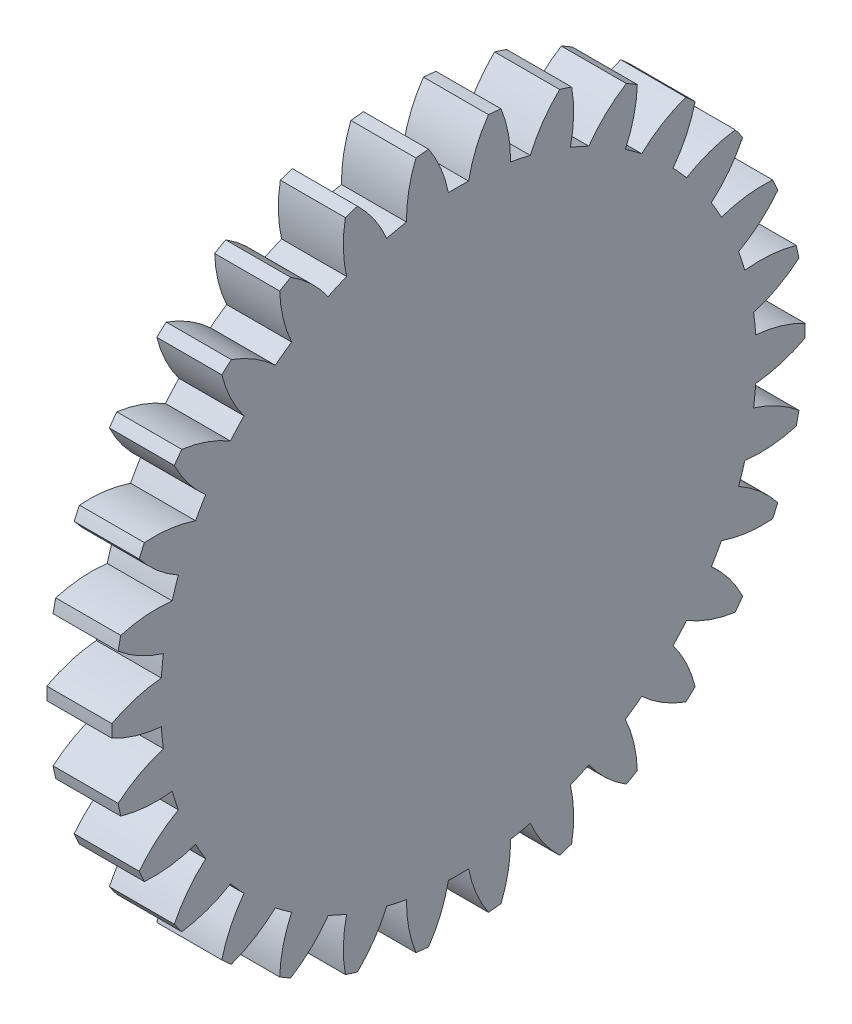
from build123d import *

# Parameters (mm, degrees)
BASPROSKE_W     = 3
BASPROSKE_H     = 16
TOOTHCUT_DEPTH  = 23.825424421
TEETHCUTS_COUNT = 30
TEETHCUTS_ANGLE = 348
BORSKE_R        = 4
BORE_DEPTH      = 50.0000508
EXTRUDE_START   = -3
SKETCH_1_R      = 4
EXTRUDE_1_DEPTH = 3


with BuildPart() as part:
    # BasProSke → Base-Revolve (revolve)
    with BuildSketch(Plane(origin=(0, 0, 0), x_dir=(1, 0, 0), z_dir=(0, 1, 0)), mode=Mode.PRIVATE) as base_revolve_sk:
        with Locations((1.5, 8)):
            Rectangle(BASPROSKE_W, BASPROSKE_H)
    revolve(base_revolve_sk.sketch.rotate(Axis((-10, 0, 0), (1, 0, 0)), 180), axis=Axis((-10, 0, 0), (1, 0, 0)))

    # TooCutSke → ToothCut (cut, through all)
    with BuildSketch(Plane(origin=(0, 0, 0), x_dir=(0, 0, -1), z_dir=(1, 0, 0))):
        with BuildLine():
            ThreePointArc((0.466400716, 13.741086979), (0, 13.749), (-0.466400716, 13.741086979))
            ThreePointArc((-0.466400716, 13.741086979), (-0.819142092, 14.899954875), (-1.3974676, 15.964351834))
            ThreePointArc((-1.3974676, 15.964351834), (0, 16.0254), (1.3974676, 15.964351834))
            ThreePointArc((1.3974676, 15.964351834), (0.819142092, 14.899954875), (0.466400716, 13.741086979))
        make_face()
    toothcut = extrude(amount=TOOTHCUT_DEPTH, mode=Mode.SUBTRACT)

    # TeethCuts: ToothCut ×30 about axis
    teethcuts_axis = Axis((-10, 0, 0), (1, 0, 0))
    for i in range(1, TEETHCUTS_COUNT):
        add(toothcut.rotate(teethcuts_axis, i * TEETHCUTS_ANGLE / (TEETHCUTS_COUNT - 1)), mode=Mode.SUBTRACT)

    # BorSke → Bore (cut, symmetric)
    with BuildSketch(Plane(origin=(0, 0, 0), x_dir=(0, 0, -1), z_dir=(1, 0, 0))):
        with Locations(Location((0, 0, 0), (0, 0, 180))):
            Circle(BORSKE_R)
    extrude(amount=BORE_DEPTH, both=True, mode=Mode.SUBTRACT)

    # ｽｹｯﾁ1 → ﾎﾞｽ - 押し出し1 (add)
    with BuildSketch(Plane.ZY.offset(EXTRUDE_START)):
        Circle(SKETCH_1_R)
    extrude(amount=EXTRUDE_1_DEPTH)


solid = part.part
